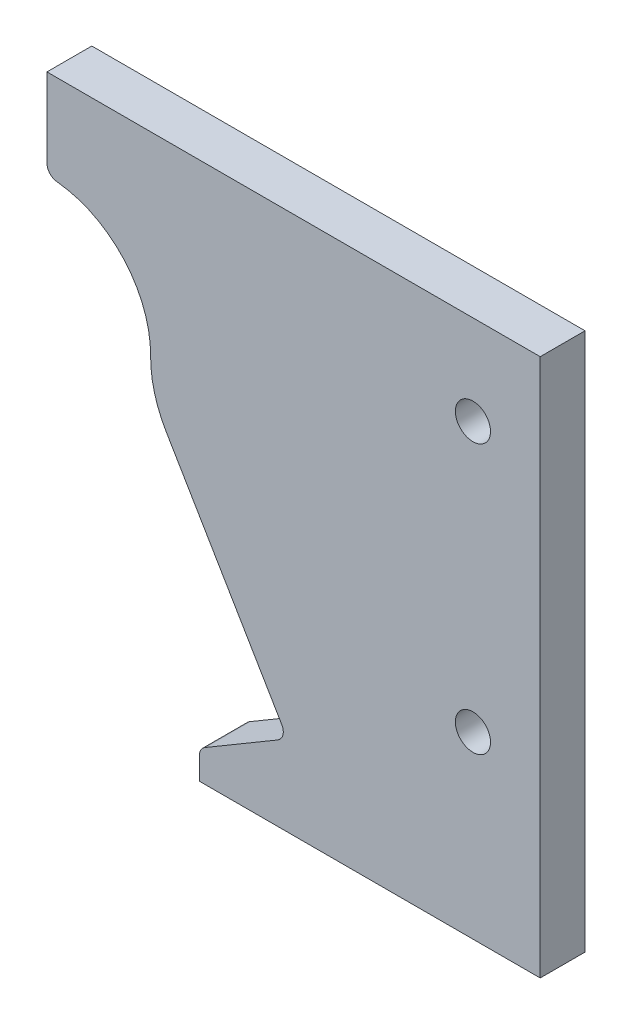
from build123d import *

# Parameters (mm, degrees)
SKETCH1_R           = 2.4892
BOSS_EXTRUDE1_DEPTH = 3.175
FILLET1_R           = 1.5875


with BuildPart() as part:
    # Sketch1 → Boss-Extrude1 (new, symmetric)
    with BuildSketch(Plane.XY):
        with BuildLine():
            Line((69.85, 27.3812), (69.85, -48.8188))
            Line((69.85, -48.8188), (21.576606, -48.8188))
            Line((21.576606, -48.8188), (21.576606, -44.762860113))
            Line((21.576606, -44.762860113), (34.055016522, -37.397839205))
            Line((34.055016522, -37.397839205), (16.883960941, -8.3052564))
            ThreePointArc((16.883960941, -8.3052564), (15.225065006, -4.359245427), (14.68076155, -0.11346257))
            ThreePointArc((14.68076155, -0.11346257), (10.421213944, 10.340983192), (0, 14.6812))
            Line((0, 14.6812), (0, 27.3812))
            Line((0, 27.3812), (69.85, 27.3812))
        make_face()
        with Locations((60.325, 14.6812)):
            Circle(SKETCH1_R, mode=Mode.SUBTRACT)
        with Locations((60.325, -23.4188)):
            Circle(SKETCH1_R, mode=Mode.SUBTRACT)
    extrude(amount=BOSS_EXTRUDE1_DEPTH, both=True)

    # Fillet1
    fillet1_edges = [part.edges().sort_by_distance(p)[0] for p in [
        (21.576606, -44.762860113, 0),
        (34.055016522, -37.397839205, 0),
        (0, 14.6812, 0),
    ]]
    fillet(fillet1_edges, radius=FILLET1_R)


solid = part.part
